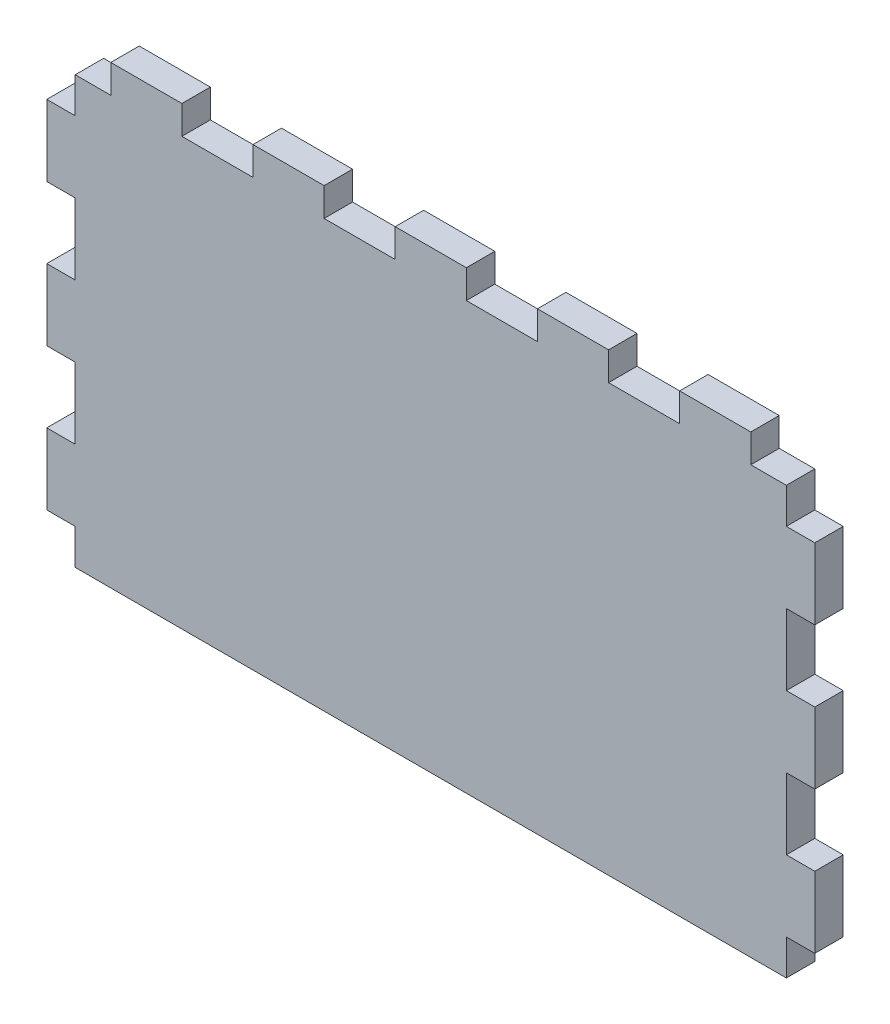
from build123d import *

# Parameters (mm, degrees)
SKETCH1_W           = 100
SKETCH1_H           = 60
SKETCH1_W_2         = 10
SKETCH1_H_2         = 8
SKETCH1_W_3         = 8
SKETCH1_H_3         = 10
BOSS_EXTRUDE1_DEPTH = 4


with BuildPart() as part:
    # Sketch1 → Boss-Extrude1 (new body)
    with BuildSketch(Plane.XY):
        Rectangle(SKETCH1_W, SKETCH1_H)
        with Locations((-40, 30)):
            Rectangle(SKETCH1_W_2, SKETCH1_H_2)
        with Locations((-20, 30)):
            Rectangle(SKETCH1_W_2, SKETCH1_H_2)
        with Locations((0, 30)):
            Rectangle(SKETCH1_W_2, SKETCH1_H_2)
        with Locations((20, 30)):
            Rectangle(SKETCH1_W_2, SKETCH1_H_2)
        with Locations((40, 30)):
            Rectangle(SKETCH1_W_2, SKETCH1_H_2)
        with Locations((50, 20)):
            Rectangle(SKETCH1_W_3, SKETCH1_H_3)
        with Locations((50, 0)):
            Rectangle(SKETCH1_W_3, SKETCH1_H_3)
        with Locations((50, -20)):
            Rectangle(SKETCH1_W_3, SKETCH1_H_3)
        with Locations((-50, 20)):
            Rectangle(SKETCH1_W_3, SKETCH1_H_3)
        with Locations((-50, 0)):
            Rectangle(SKETCH1_W_3, SKETCH1_H_3)
        with Locations((-50, -20)):
            Rectangle(SKETCH1_W_3, SKETCH1_H_3)
    extrude(amount=BOSS_EXTRUDE1_DEPTH)


solid = part.part
